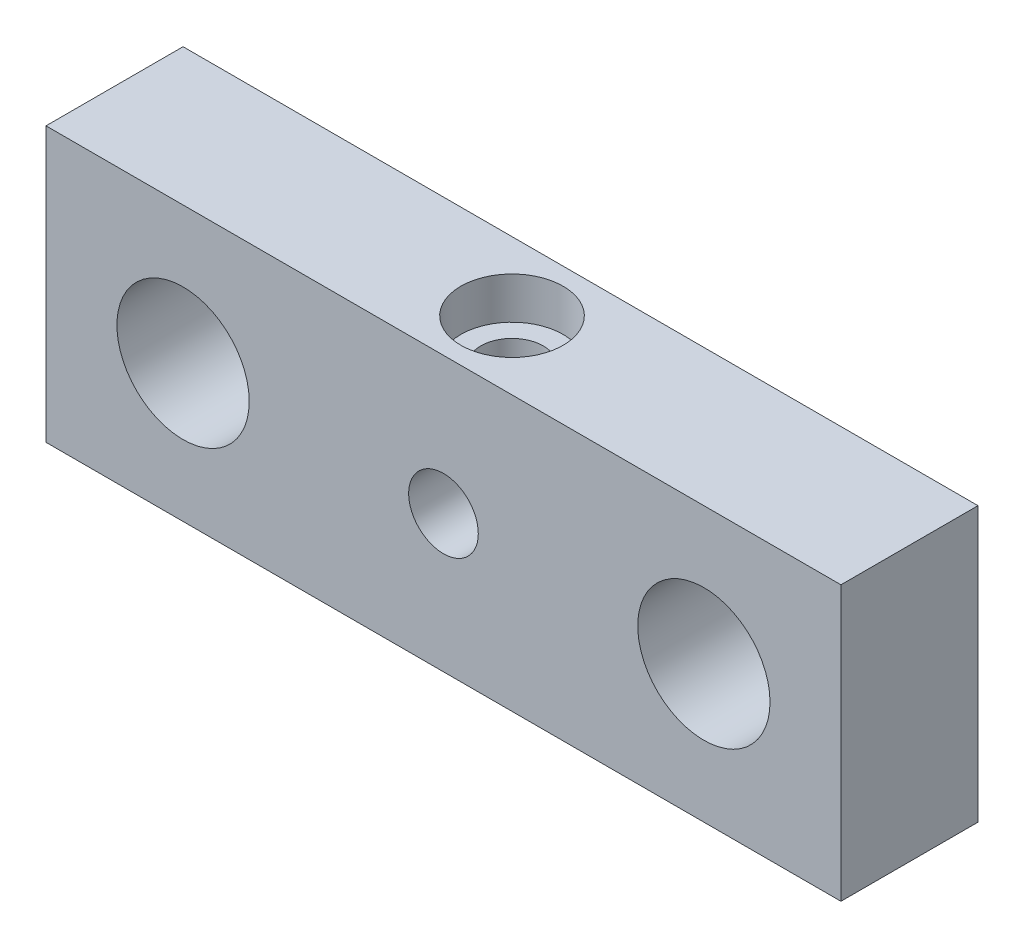
from build123d import *

# Parameters (mm, degrees)
SKETCH1_W               = 29
SKETCH1_H               = 10
BOSS_EXTRUDE1_DEPTH     = 5
SKETCH2_R               = 2.413
CUT_EXTRUDE1_DEPTH      = 17.132265805
SKETCH3_R               = 1.27
CUT_EXTRUDE2_DEPTH      = 17.132265805
SKETCH4_R               = 1.8669
CUT_EXTRUDE3_DEPTH      = 1.524
CUT_EXTRUDE4_REACH      = 19.524
CUT_EXTRUDE4_END_RADIUS = 1.27
SKETCH5_R               = 1.143


with BuildPart() as part:
    # Sketch1 → Boss-Extrude1 (new body)
    with BuildSketch(Plane.XY):
        Rectangle(SKETCH1_W, SKETCH1_H)
    extrude(amount=BOSS_EXTRUDE1_DEPTH)

    # Sketch2 → Cut-Extrude1 (cut, through all)
    with BuildSketch(Plane.XY.offset(5)):
        with Locations((-9.5, 0)):
            Circle(SKETCH2_R)
        with Locations((9.5, 0)):
            Circle(SKETCH2_R)
    extrude(amount=-CUT_EXTRUDE1_DEPTH, mode=Mode.SUBTRACT)

    # Sketch3 → Cut-Extrude2 (cut, through all)
    with BuildSketch(Plane.XY.offset(5)):
        Circle(SKETCH3_R)
    extrude(amount=-CUT_EXTRUDE2_DEPTH, mode=Mode.SUBTRACT)

    # Sketch4 → Cut-Extrude3 (cut)
    with BuildSketch(Plane(origin=(0, 5, 0), x_dir=(1, 0, 0), z_dir=(0, 1, 0))):
        with Locations(Location((0, -2.5, 0), (0, 0, 180))):
            Circle(SKETCH4_R)
    extrude(amount=-CUT_EXTRUDE3_DEPTH, mode=Mode.SUBTRACT)

    # Cut-Extrude4: up to this cylinder (the profile starts outside it)
    cut_extrude4_end = Plane(origin=(0, 0, 2.5), z_dir=(0, 0, 1)) * Cylinder(CUT_EXTRUDE4_END_RADIUS, 42.588, mode=Mode.PRIVATE)
    # Sketch5 → Cut-Extrude4 (cut, up to the surface)
    with BuildSketch(Plane(origin=(0, 3.476, 0), x_dir=(1, 0, 0), z_dir=(0, 1, 0)), mode=Mode.PRIVATE) as cut_extrude4_sk1:
        with Locations(Location((0, -2.5, 0), (0, 0, 180))):
            Circle(SKETCH5_R)
    cut_extrude4_tool1 = extrude(cut_extrude4_sk1.sketch, amount=-CUT_EXTRUDE4_REACH, mode=Mode.PRIVATE) - cut_extrude4_end
    add(cut_extrude4_tool1.solids().sort_by_distance((0, 3.476, 2.5))[0], mode=Mode.SUBTRACT)


solid = part.part
